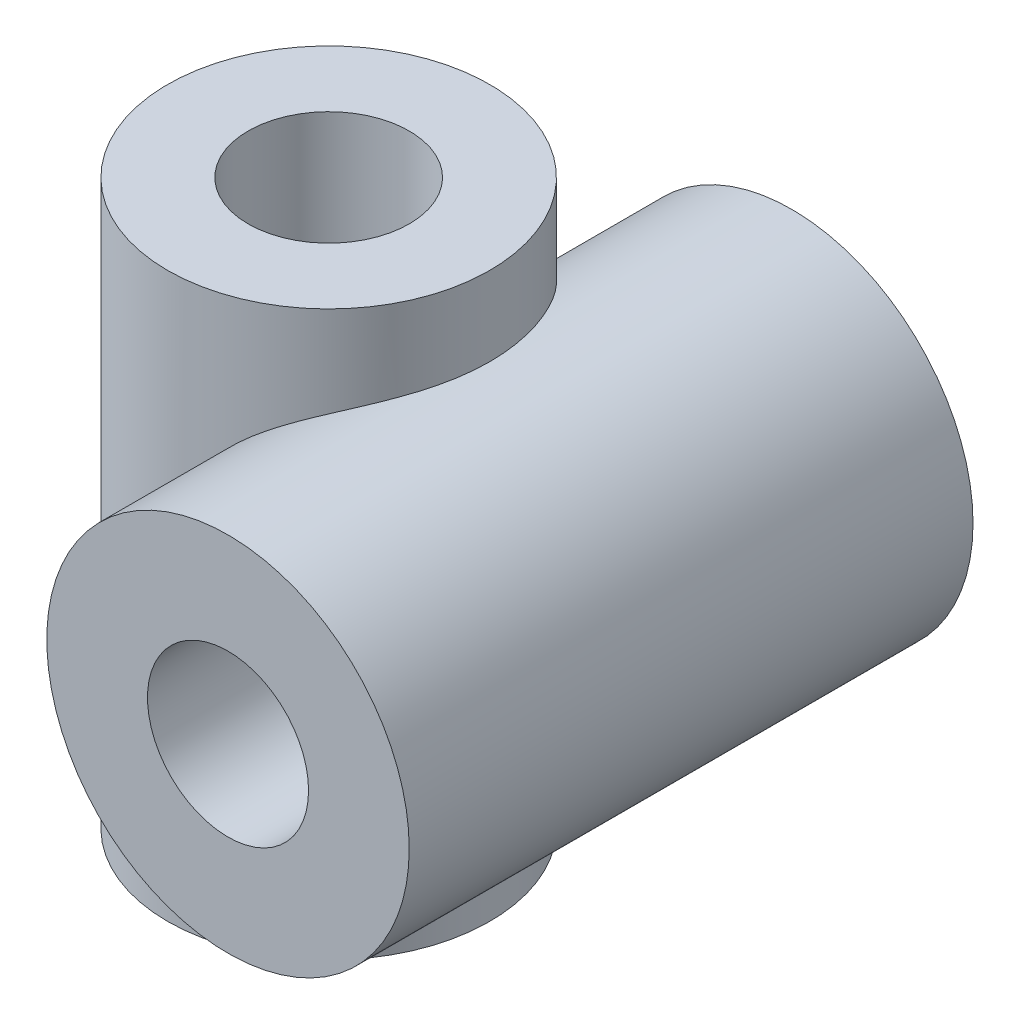
from build123d import *

# Parameters (mm, degrees)
SKETCH1_R                = 16
SKETCH1_R_2              = 8
BOSS_EXTRUDE1_DEPTH      = 56
BOSS_EXTRUDE2_DEPTH      = 28
BOSS_EXTRUDE2_DEPTH_BACK = 28
SKETCH2_R                = 18
SKETCH2_R_2              = 8
SKETCH3_R                = 8
CUT_EXTRUDE1_DEPTH       = 73.221880507
SKETCH4_R                = 8
CUT_EXTRUDE2_DEPTH       = 87.994252854


with BuildPart() as part:
    # Sketch1 → Boss-Extrude1 (new body)
    with BuildSketch(Plane(origin=(0, 0, 0), x_dir=(1, 0, 0), z_dir=(0, 1, 0))):
        Circle(SKETCH1_R)
        Circle(SKETCH1_R_2, mode=Mode.SUBTRACT)
    extrude(amount=BOSS_EXTRUDE1_DEPTH)

    # Sketch2 → Boss-Extrude2 (add, two sides: drawn at the far end of the back side and taken through both)
    with BuildSketch(Plane.XY.offset(-BOSS_EXTRUDE2_DEPTH_BACK)):
        with Locations((18, 30.258098715)):
            Circle(SKETCH2_R)
        with Locations((18, 30.258098715)):
            Circle(SKETCH2_R_2, mode=Mode.SUBTRACT)
    extrude(amount=BOSS_EXTRUDE2_DEPTH + BOSS_EXTRUDE2_DEPTH_BACK)

    # Sketch3 → Cut-Extrude1 (cut, through all)
    with BuildSketch(Plane(origin=(0, 56, 0), x_dir=(1, 0, 0), z_dir=(0, 1, 0))):
        Circle(SKETCH3_R)
    extrude(amount=-CUT_EXTRUDE1_DEPTH, mode=Mode.SUBTRACT)

    # Sketch4 → Cut-Extrude2 (cut, through all)
    with BuildSketch(Plane.XY.offset(28)):
        with Locations((18, 30.258098715)):
            Circle(SKETCH4_R)
    extrude(amount=-CUT_EXTRUDE2_DEPTH, mode=Mode.SUBTRACT)


solid = part.part
